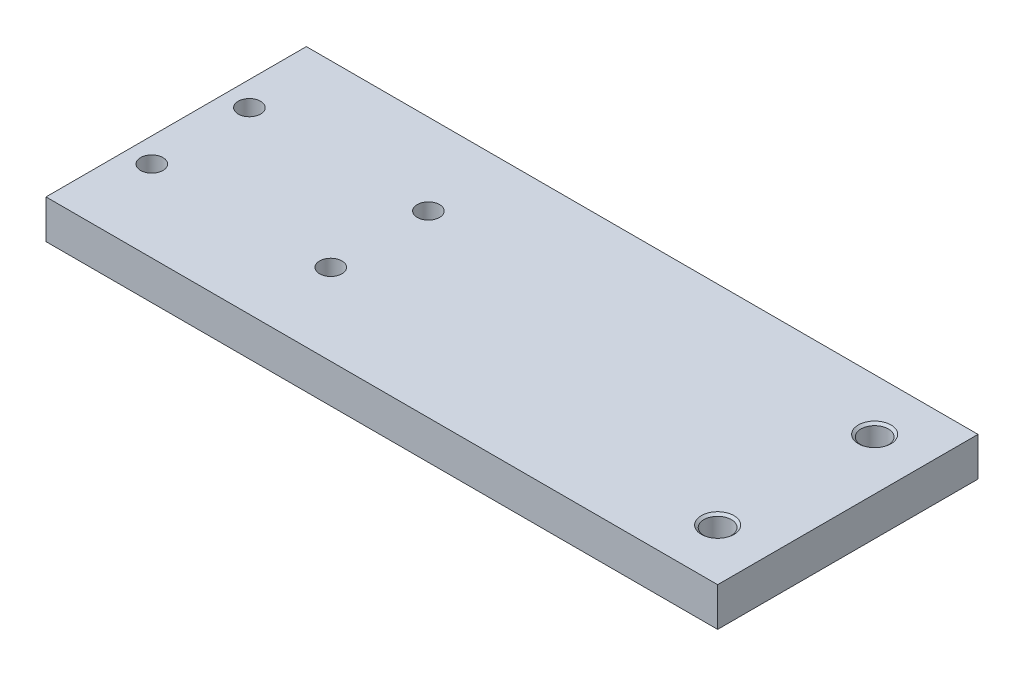
from build123d import *

# Parameters (mm, degrees)
SKETCH1_W                         = 165.1
SKETCH1_H                         = 64
BOSS_EXTRUDE1_DEPTH               = 9.525
F_1_4_CLEARANCE_HOLE1_D           = 6.7564
F_1_4_CLEARANCE_HOLE1_CSINK_D     = 8.0264
F_1_4_CLEARANCE_HOLE1_CSINK_ANGLE = 100
CBORE_FOR_M5_SHCS1_AT_2_COUNT     = 2
CBORE_FOR_M5_SHCS1_AT_2_PITCH     = 44
CBORE_FOR_M5_SHCS1_AT_3_COUNT     = 2
CBORE_FOR_M5_SHCS1_AT_3_PITCH     = 50.119856345
CBORE_FOR_M5_SHCS1_AT_4_COUNT     = 2
CBORE_FOR_M5_SHCS1_AT_4_PITCH     = 24


with BuildPart() as part:
    # Sketch1 → Boss-Extrude1 (new body)
    with BuildSketch(Plane(origin=(0, 0, 0), x_dir=(1, 0, 0), z_dir=(0, 1, 0))):
        with Locations((82.55, 32)):
            Rectangle(SKETCH1_W, SKETCH1_H)
    extrude(amount=BOSS_EXTRUDE1_DEPTH)

    # 1/4 Clearance Hole1 (through all)
    with Locations(Plane(origin=(0, 9.525, 0), x_dir=(1, 0, 0), z_dir=(0, 1, 0))):
        with Locations((152.4, 51.3), (152.4, 12.7)):
            CounterSinkHole(F_1_4_CLEARANCE_HOLE1_D / 2, F_1_4_CLEARANCE_HOLE1_CSINK_D / 2, counter_sink_angle=F_1_4_CLEARANCE_HOLE1_CSINK_ANGLE)

    # Sketch7 → CBORE for M5 SHCS1 (revolve, cut)
    with BuildSketch(Plane(origin=(6, 0, -44), x_dir=(0, 0, -1), z_dir=(1, 0, 0))):
        Polygon((0, 0), (0, 9.525), (2.75, 9.525), (2.75, 5), (5, 5), (5, 0.020977491), (5.025, 0), align=None)
    cbore_for_m5_shcs1 = revolve(axis=Axis((6, -6.35, -44), (0, 1, 0)), mode=Mode.SUBTRACT)

    # CBORE for M5 SHCS1 at 2: CBORE for M5 SHCS1 ×2
    with Locations(*[(i * CBORE_FOR_M5_SHCS1_AT_2_PITCH, 0, 0) for i in range(1, CBORE_FOR_M5_SHCS1_AT_2_COUNT)]):
        add(cbore_for_m5_shcs1, mode=Mode.SUBTRACT)

    # CBORE for M5 SHCS1 at 3: CBORE for M5 SHCS1 ×2
    with Locations(*[Vector(0.8778955729143844, 0, 0.4788521306805733) * (i * CBORE_FOR_M5_SHCS1_AT_3_PITCH) for i in range(1, CBORE_FOR_M5_SHCS1_AT_3_COUNT)]):
        add(cbore_for_m5_shcs1, mode=Mode.SUBTRACT)

    # CBORE for M5 SHCS1 at 4: CBORE for M5 SHCS1 ×2
    with Locations(*[(0, 0, i * CBORE_FOR_M5_SHCS1_AT_4_PITCH) for i in range(1, CBORE_FOR_M5_SHCS1_AT_4_COUNT)]):
        add(cbore_for_m5_shcs1, mode=Mode.SUBTRACT)


solid = part.part
